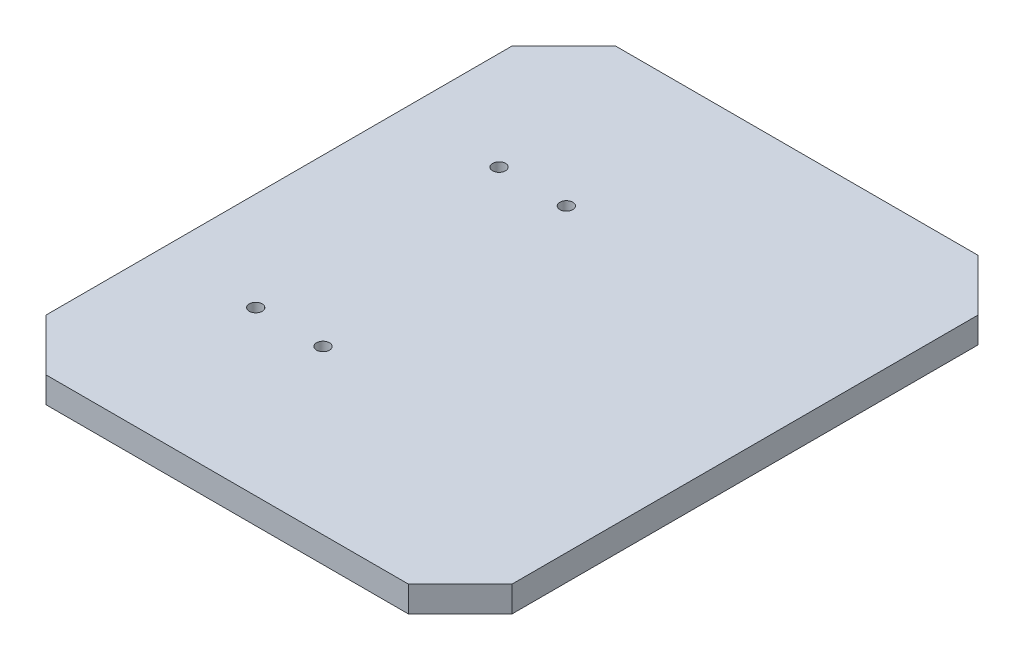
from build123d import *

# Parameters (mm, degrees)
SKETCH_1_W         = 90
SKETCH_1_H         = 110
EXTRUDE_1_DEPTH    = 5
CHAMFER_1_SIZE     = 10
HOLE_WIZARD_M3_1_D = 2.5


with BuildPart() as part:
    # 草图1 → 凸台-拉伸1 (new body)
    with BuildSketch(Plane(origin=(0, 0, 0), x_dir=(1, 0, 0), z_dir=(0, 1, 0))):
        with Locations((45, 55)):
            Rectangle(SKETCH_1_W, SKETCH_1_H)
    extrude(amount=EXTRUDE_1_DEPTH)

    # 倒角1
    chamfer_1_edges = [part.edges().sort_by_distance(p)[0] for p in [
        (0, 2.5, 0),
        (0, 2.5, -110),
        (90, 2.5, -110),
        (90, 2.5, 0),
    ]]
    chamfer(chamfer_1_edges, length=CHAMFER_1_SIZE)

    # M3 螺纹孔1 (through all)
    with Locations(Plane(origin=(0, 0, 0), x_dir=(-1, 0, 0), z_dir=(0, -1, 0))):
        with Locations((-19, 78.5), (-19, 31.5), (-32, 31.5), (-32, 78.5)):
            Hole(HOLE_WIZARD_M3_1_D / 2)


solid = part.part
